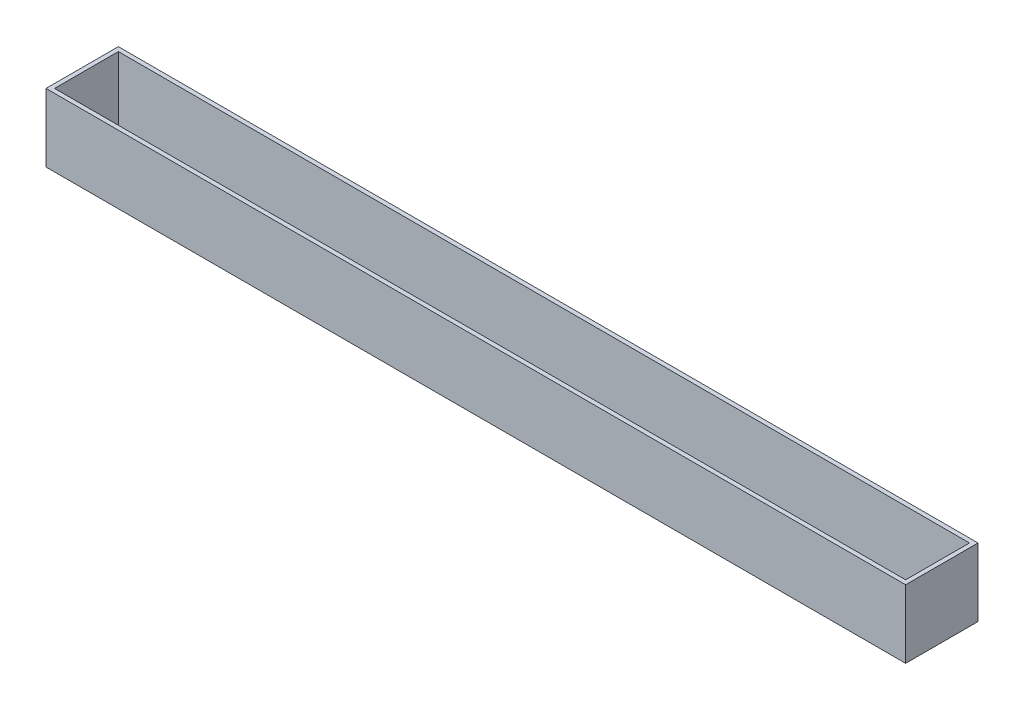
from build123d import *

# Parameters (mm, degrees)
SKETCH1_W           = 404
SKETCH1_H           = 34
BOSS_EXTRUDE1_DEPTH = 32
SKETCH2_W           = 400
SKETCH2_H           = 30
CUT_EXTRUDE3_DEPTH  = 30


with BuildPart() as part:
    # Sketch1 → Boss-Extrude1 (new body)
    with BuildSketch(Plane(origin=(0, 0, 0), x_dir=(1, 0, 0), z_dir=(0, 1, 0))):
        with Locations((139.195777904, 17)):
            Rectangle(SKETCH1_W, SKETCH1_H)
    extrude(amount=BOSS_EXTRUDE1_DEPTH)

    # Sketch2 → Cut-Extrude3 (cut)
    with BuildSketch(Plane(origin=(0, 32, 0), x_dir=(1, 0, 0), z_dir=(0, 1, 0))):
        with Locations((139.195777904, 17)):
            Rectangle(SKETCH2_W, SKETCH2_H)
    extrude(amount=-CUT_EXTRUDE3_DEPTH, mode=Mode.SUBTRACT)


solid = part.part
